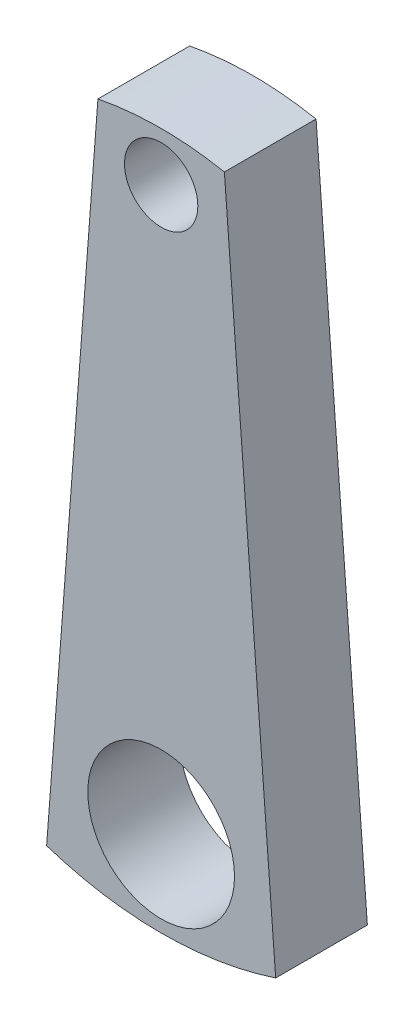
from build123d import *

# Parameters (mm, degrees)
SKETCH1_R           = 6
SKETCH1_R_2         = 12
BOSS_EXTRUDE1_DEPTH = 15


with BuildPart() as part:
    # Sketch1 → Boss-Extrude1 (new body)
    with BuildSketch(Plane.XY):
        with BuildLine():
            Line((-10.344080433, 53), (-18.734993995, -57))
            ThreePointArc((-18.734993995, -57), (0, -60), (18.734993995, -57))
            Line((18.734993995, -57), (10.344080433, 53))
            ThreePointArc((10.344080433, 53), (0, 54), (-10.344080433, 53))
        make_face()
        with Locations((0, 46)):
            Circle(SKETCH1_R, mode=Mode.SUBTRACT)
        with Locations((0, -46)):
            Circle(SKETCH1_R_2, mode=Mode.SUBTRACT)
    extrude(amount=BOSS_EXTRUDE1_DEPTH)


solid = part.part
